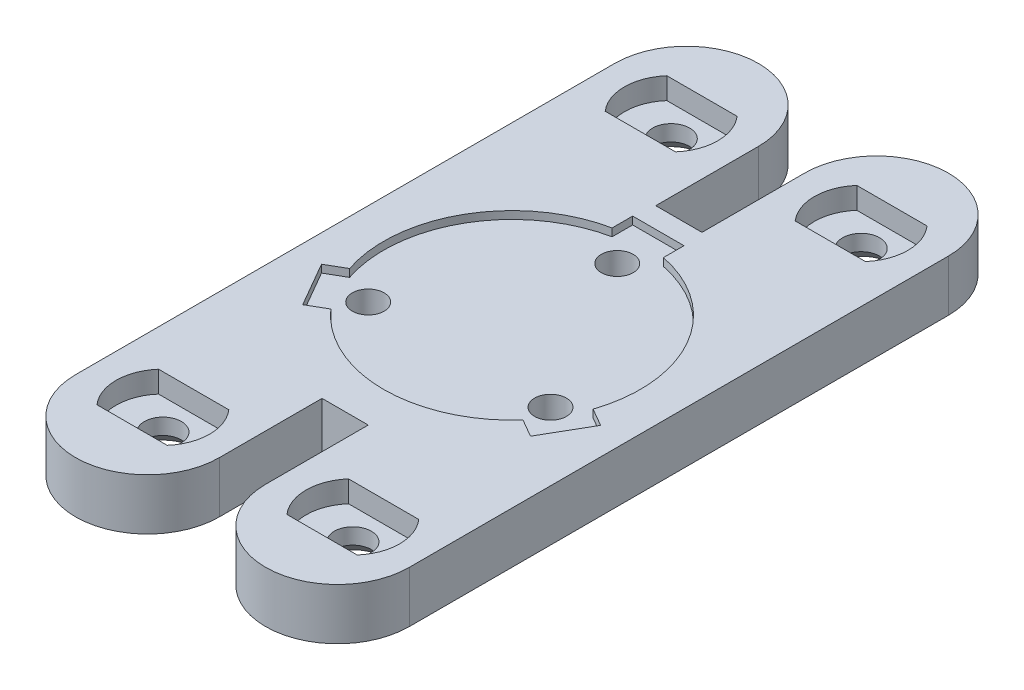
from build123d import *

# Parameters (mm, degrees)
BOSS_EXTRUDE1_DEPTH                               = 5
CSK_FOR_M3_FLAT_HEAD_MACHINE_SCREW1_D             = 3.6
CSK_FOR_M3_FLAT_HEAD_MACHINE_SCREW1_CSINK_D       = 6.3
CSK_FOR_M3_FLAT_HEAD_MACHINE_SCREW1_CSINK_ANGLE   = 90
SKETCH16_R                                        = 1.8
CUT_EXTRUDE7_DEPTH                                = 2.1
MIRROR6_COPY_1_DEPTH                              = 5
MIRROR6_COPY_2_D                                  = 3.6
MIRROR6_COPY_2_CSINK_D                            = 6.3
MIRROR6_COPY_2_CSINK_ANGLE                        = 90
MIRROR6_COPY_3_SKETCH_R                           = 1.8
MIRROR6_COPY_3_DEPTH                              = 2.1
SKETCH6_R                                         = 12.5
CUT_EXTRUDE2_DEPTH                                = 0.75
SKETCH6_4_R                                       = 12.5
SKETCH6_4_W                                       = 5
SKETCH6_4_H                                       = 3.5
CUT_EXTRUDE5_DEPTH                                = 0.75
CSK_FOR_M2_5_FLAT_HEAD_MACHINE_SCREW3_D           = 3.1
CSK_FOR_M2_5_FLAT_HEAD_MACHINE_SCREW3_CSINK_D     = 5.5
CSK_FOR_M2_5_FLAT_HEAD_MACHINE_SCREW3_CSINK_ANGLE = 90
CIRPATTERN1_COUNT                                 = 3


with BuildPart() as part:
    # Sketch1 → Boss-Extrude1 (new body)
    with BuildSketch(Plane(origin=(0, 0, 0), x_dir=(1, 0, 0), z_dir=(0, 1, 0))):
        with BuildLine():
            Line((-16.25, 26.25), (-16.25, 16.25))
            Line((-16.25, 16.25), (-2.25, 16.25))
            Line((-2.25, 16.25), (-2.25, 26.25))
            ThreePointArc((-2.25, 26.25), (-9.25, 33.25), (-16.25, 26.25))
        make_face()
        Polygon((-2.25, 16.25), (-16.25, 16.25), (-16.25, -16.25), (16.25, -16.25), (16.25, 16.25), align=None)
    boss_extrude1 = extrude(amount=BOSS_EXTRUDE1_DEPTH)

    # CSK for M3 Flat Head Machine Screw1 (through all)
    with Locations(Plane.XZ):
        with Locations((-9.25, -24.75)):
            csk_for_m3_flat_head_machine_screw1 = CounterSinkHole(CSK_FOR_M3_FLAT_HEAD_MACHINE_SCREW1_D / 2, CSK_FOR_M3_FLAT_HEAD_MACHINE_SCREW1_CSINK_D / 2, counter_sink_angle=CSK_FOR_M3_FLAT_HEAD_MACHINE_SCREW1_CSINK_ANGLE)

    # Sketch16 → Cut-Extrude7 (cut)
    with BuildSketch(Plane(origin=(0, 5, 0), x_dir=(1, 0, 0), z_dir=(0, 1, 0))):
        with BuildLine():
            Line((-5.829108303, 27.75), (-12.670891697, 27.75))
            ThreePointArc((-12.670891697, 27.75), (-13.8, 24.75), (-12.670891697, 21.75))
            Line((-12.670891697, 21.75), (-5.829108303, 21.75))
            ThreePointArc((-5.829108303, 21.75), (-4.991622538, 23.147276883), (-4.7, 24.75))
            ThreePointArc((-4.7, 24.75), (-4.991622538, 26.352723117), (-5.829108303, 27.75))
        make_face()
        with Locations(Location((-9.25, 24.75, 0), (0, 0, 90))):
            Circle(SKETCH16_R, mode=Mode.SUBTRACT)
    cut_extrude7 = extrude(amount=-CUT_EXTRUDE7_DEPTH, mode=Mode.SUBTRACT)

    # Mirror2: Boss-Extrude1, CSK for M3 Flat Head Machine Screw1, Cut-Extrude7 across plane
    add(boss_extrude1.mirror(Plane(origin=(0, 0, 0), x_dir=(0, 0, 1), z_dir=(1, 0, 0))))
    add(csk_for_m3_flat_head_machine_screw1.mirror(Plane(origin=(0, 0, 0), x_dir=(0, 0, 1), z_dir=(1, 0, 0))), mode=Mode.SUBTRACT)
    add(cut_extrude7.mirror(Plane(origin=(0, 0, 0), x_dir=(0, 0, 1), z_dir=(1, 0, 0))), mode=Mode.SUBTRACT)

    # Mirror6: Boss-Extrude1, CSK for M3 Flat Head Machine Screw1, Cut-Extrude7 across plane
    add(boss_extrude1.mirror(Plane.XY))
    add(csk_for_m3_flat_head_machine_screw1.mirror(Plane.XY), mode=Mode.SUBTRACT)
    add(cut_extrude7.mirror(Plane.XY), mode=Mode.SUBTRACT)

    # Mirror6 copy 1 sketch → Mirror6 copy 1 (add)
    with BuildSketch(Plane(origin=(0, 0, 0), x_dir=(-1, 0, 0), z_dir=(0, 1, 0))):
        with BuildLine():
            Line((-16.25, 26.25), (-16.25, 16.25))
            Line((-16.25, 16.25), (-2.25, 16.25))
            Line((-2.25, 16.25), (-2.25, 26.25))
            ThreePointArc((-2.25, 26.25), (-9.25, 33.25), (-16.25, 26.25))
        make_face()
        Polygon((-2.25, 16.25), (-16.25, 16.25), (-16.25, -16.25), (16.25, -16.25), (16.25, 16.25), align=None)
    extrude(amount=MIRROR6_COPY_1_DEPTH)

    # Mirror6 copy 2 (through all)
    with Locations(Plane(origin=(0, 0, 0), x_dir=(-1, 0, 0), z_dir=(0, -1, 0))):
        with Locations((-9.25, -24.75)):
            CounterSinkHole(MIRROR6_COPY_2_D / 2, MIRROR6_COPY_2_CSINK_D / 2, counter_sink_angle=MIRROR6_COPY_2_CSINK_ANGLE)

    # Mirror6 copy 3 sketch → Mirror6 copy 3 (cut)
    with BuildSketch(Plane(origin=(0, 5, 0), x_dir=(-1, 0, 0), z_dir=(0, 1, 0))):
        with BuildLine():
            Line((-5.829108303, 27.75), (-12.670891697, 27.75))
            ThreePointArc((-12.670891697, 27.75), (-13.8, 24.75), (-12.670891697, 21.75))
            Line((-12.670891697, 21.75), (-5.829108303, 21.75))
            ThreePointArc((-5.829108303, 21.75), (-4.991622538, 23.147276883), (-4.7, 24.75))
            ThreePointArc((-4.7, 24.75), (-4.991622538, 26.352723117), (-5.829108303, 27.75))
        make_face()
        with Locations(Location((-9.25, 24.75, 0), (0, 0, 90))):
            Circle(MIRROR6_COPY_3_SKETCH_R, mode=Mode.SUBTRACT)
    extrude(amount=-MIRROR6_COPY_3_DEPTH, mode=Mode.SUBTRACT)

    # Sketch6 → Cut-Extrude2 (cut)
    with BuildSketch(Plane(origin=(0, 5, 0), x_dir=(1, 0, 0), z_dir=(0, 1, 0))):
        with Locations(Location((0, 0, 0), (0, 0, 270))):
            Circle(SKETCH6_R)
    extrude(amount=-CUT_EXTRUDE2_DEPTH, mode=Mode.SUBTRACT)

    # Sketch6<4> → Cut-Extrude5 (cut)
    with BuildSketch(Plane(origin=(0, 5, 0), x_dir=(1, 0, 0), z_dir=(0, 1, 0))):
        Circle(SKETCH6_4_R)
        with Locations((0, 12.5)):
            Rectangle(SKETCH6_4_W, SKETCH6_4_H)
    cut_extrude5 = extrude(amount=-CUT_EXTRUDE5_DEPTH, mode=Mode.SUBTRACT)

    # CSK for M2.5 Flat Head Machine Screw3 (through all)
    with Locations(Plane.XZ):
        with Locations((0, -10.25)):
            csk_for_m2_5_flat_head_machine_screw3 = CounterSinkHole(CSK_FOR_M2_5_FLAT_HEAD_MACHINE_SCREW3_D / 2, CSK_FOR_M2_5_FLAT_HEAD_MACHINE_SCREW3_CSINK_D / 2, counter_sink_angle=CSK_FOR_M2_5_FLAT_HEAD_MACHINE_SCREW3_CSINK_ANGLE)

    # CirPattern1: Cut-Extrude5, CSK for M2.5 Flat Head Machine Screw3 ×3 about axis
    cirpattern1_axis = Axis((0, 0, 0), (0, 1, 0))
    add([cut_extrude5.rotate(cirpattern1_axis, i * 360 / CIRPATTERN1_COUNT) for i in range(1, CIRPATTERN1_COUNT)], mode=Mode.SUBTRACT)
    add([csk_for_m2_5_flat_head_machine_screw3.rotate(cirpattern1_axis, i * 360 / CIRPATTERN1_COUNT) for i in range(1, CIRPATTERN1_COUNT)], mode=Mode.SUBTRACT)


solid = part.part
